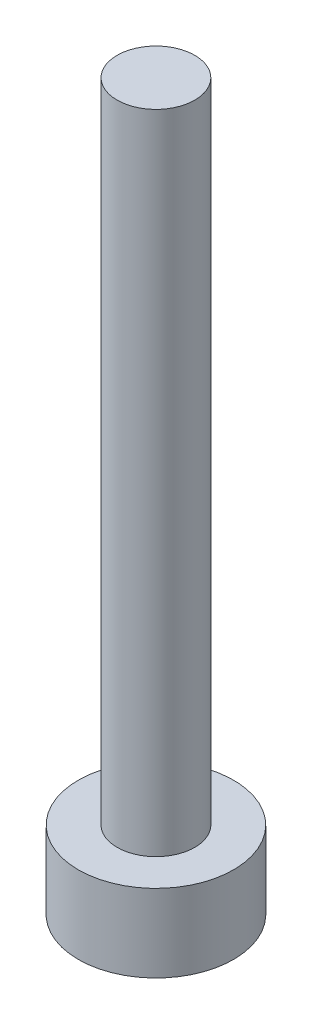
from build123d import *

# Parameters (mm, degrees)
SKETCH_1_R      = 3
EXTRUDE_1_DEPTH = 3
SKETCH_2_R      = 1.5
EXTRUDE_2_DEPTH = 25


with BuildPart() as part:
    # 草图1 → 凸台-拉伸1 (new body)
    with BuildSketch(Plane(origin=(0, 0, 0), x_dir=(1, 0, 0), z_dir=(0, 1, 0))):
        with Locations(Location((0, 0, 0), (0, 0, 270))):
            Circle(SKETCH_1_R)
    extrude(amount=EXTRUDE_1_DEPTH)

    # 草图2 → 凸台-拉伸2 (add)
    with BuildSketch(Plane(origin=(0, 3, 0), x_dir=(1, 0, 0), z_dir=(0, 1, 0))):
        with Locations(Location((0, 0, 0), (0, 0, 270))):
            Circle(SKETCH_2_R)
    extrude(amount=EXTRUDE_2_DEPTH)


solid = part.part
